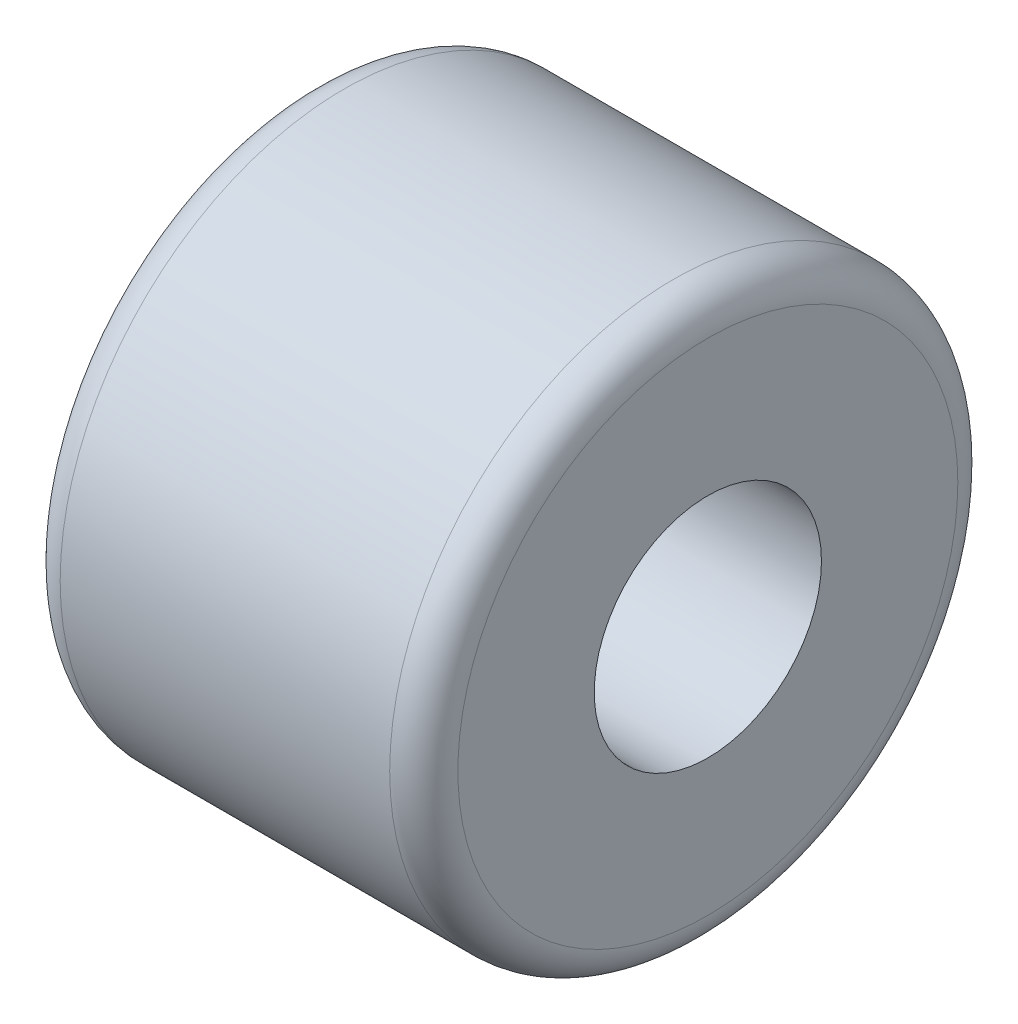
from build123d import *

# Parameters (mm, degrees)
SKETCH1_R           = 25
SKETCH1_R_2         = 1.5
BOSS_EXTRUDE1_DEPTH = 35
SKETCH2_R           = 10
CUT_EXTRUDE1_DEPTH  = 20
FILLET2_R           = 3
FILLET3_R           = 3


with BuildPart() as part:
    # Sketch1 → Boss-Extrude1 (new body)
    with BuildSketch(Plane.YZ):
        with Locations(Location((0, 0, 0), (0, 0, 270))):
            Circle(SKETCH1_R)
        with Locations(Location((0, 0, 0), (0, 0, 270))):
            Circle(SKETCH1_R_2, mode=Mode.SUBTRACT)
    extrude(amount=BOSS_EXTRUDE1_DEPTH)

    # Sketch2 → Cut-Extrude1 (cut)
    with BuildSketch(Plane.YZ.offset(35)):
        with Locations(Location((0, 0, 0), (0, 0, 270))):
            Circle(SKETCH2_R)
    extrude(amount=-CUT_EXTRUDE1_DEPTH, mode=Mode.SUBTRACT)

    # Fillet2
    fillet2_edges = [part.edges().sort_by_distance(p)[0] for p in [
        (0, 0, 25),
    ]]
    fillet(fillet2_edges, radius=FILLET2_R)

    # Fillet3
    fillet3_edges = [part.edges().sort_by_distance(p)[0] for p in [
        (35, 0, 25),
    ]]
    fillet(fillet3_edges, radius=FILLET3_R)


solid = part.part
